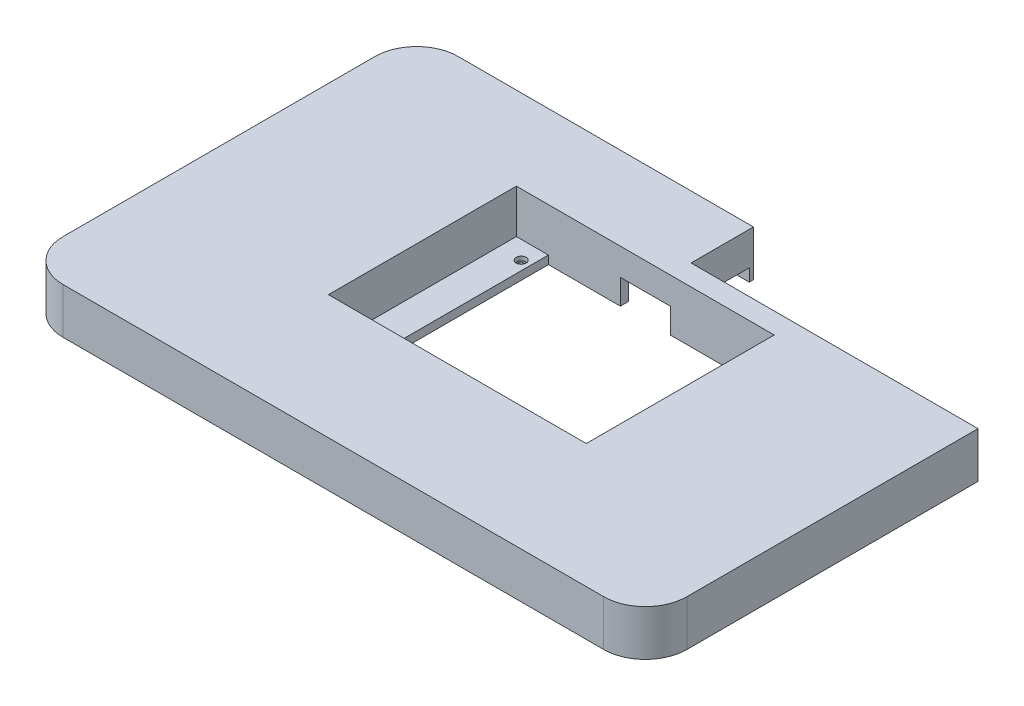
from build123d import *

# Parameters (mm, degrees)
EXTRUDE_1_DEPTH      = 1
SKETCH_2_W           = 69
SKETCH_2_H           = 15
CUT_EXTRUDE_1_DEPTH  = 1
EXTRUDE_START        = 10
EXTRUDE_2_DEPTH      = 10
SKETCH_4_R           = 2.5
EXTRUDE_3_DEPTH      = 10
SKETCH_5_R           = 1.5
CUT_EXTRUDE_2_DEPTH  = 2.8
SKETCH_6_R           = 1.1
CUT_EXTRUDE_4_DEPTH  = 4.2
SKETCH_7_W           = 68
SKETCH_7_H           = 1
EXTRUDE_4_DEPTH      = 7
SKETCH_8_R           = 2.5
EXTRUDE_5_DEPTH      = 10
SKETCH_9_R           = 1.5
CUT_EXTRUDE_5_DEPTH  = 2.8
SKETCH_10_R          = 1.1
CUT_EXTRUDE_6_DEPTH  = 4.2
SKETCH_11_W          = 62
SKETCH_11_H          = 45.2
CUT_EXTRUDE_7_DEPTH  = 10
SKETCH_12_R          = 2.5
CUT_EXTRUDE_8_DEPTH  = 10
SKETCH_13_W          = 66
SKETCH_13_H          = 49.2
SKETCH_13_W_2        = 62
SKETCH_13_H_2        = 45.2
EXTRUDE_6_DEPTH      = 11.5
EXTRUDE_9_DEPTH      = 2
SKETCH_16_R          = 2
CUT_EXTRUDE_12_DEPTH = 1
SKETCH_17_R          = 1.6
CUT_EXTRUDE_13_DEPTH = 2.8
SKETCH_18_R          = 1.2
CUT_EXTRUDE_14_DEPTH = 2
SKETCH_19_R          = 3.5
SKETCH_19_R_2        = 2.5
EXTRUDE_10_DEPTH     = 10
FILLET_2_R           = 2
SKETCH_20_W          = 62
SKETCH_20_H          = 45.2
CUT_EXTRUDE_15_DEPTH = 10.5
SKETCH_21_W          = 13.5
SKETCH_21_H          = 4.7
SKETCH_21_H_2        = 0.3
CUT_EXTRUDE_22_DEPTH = 15
SKETCH_24_W          = 10
SKETCH_24_H          = 10
SKETCH_24_W_2        = 5
EXTRUDE_11_DEPTH     = 5
SKETCH_25_W          = 5
SKETCH_25_H          = 10
EXTRUDE_12_DEPTH     = 1.6
SKETCH_27_W          = 11
SKETCH_27_H          = 5
EXTRUDE_13_DEPTH     = 1
SKETCH_28_W          = 11
SKETCH_28_H          = 5
EXTRUDE_14_DEPTH     = 1
SKETCH_29_W          = 5
SKETCH_29_H          = 2
EXTRUDE_15_DEPTH     = 6.6
SKETCH_30_W          = 6
SKETCH_30_H          = 6
CUT_EXTRUDE_23_DEPTH = 10
SKETCH_31_W          = 5
SKETCH_31_H          = 1.781037981
SKETCH_31_H_2        = 2
SKETCH_31_W_2        = 2
SKETCH_31_H_3        = 8
EXTRUDE_16_DEPTH     = 5
SKETCH_32_W          = 23
SKETCH_32_H          = 2
SKETCH_32_W_2        = 2
SKETCH_32_H_2        = 3
EXTRUDE_17_DEPTH     = 5


with BuildPart() as part:
    # 스케치1 → 보스-돌출1 (new body)
    with BuildSketch(Plane(origin=(0, 0, 0), x_dir=(1, 0, 0), z_dir=(0, 1, 0))):
        with BuildLine():
            Line((-65, 47.5), (65, 47.5))
            ThreePointArc((65, 47.5), (72.071067812, 44.571067812), (75, 37.5))
            Line((75, 37.5), (75, -37.5))
            ThreePointArc((75, -37.5), (72.071067812, -44.571067812), (65, -47.5))
            Line((65, -47.5), (-65, -47.5))
            ThreePointArc((-65, -47.5), (-72.071067812, -44.571067812), (-75, -37.5))
            Line((-75, -37.5), (-75, 37.5))
            ThreePointArc((-75, 37.5), (-72.071067812, 44.571067812), (-65, 47.5))
        make_face()
    extrude(amount=EXTRUDE_1_DEPTH)

    # 스케치2 → 컷-돌출1 (cut)
    with BuildSketch(Plane(origin=(0, 1, 0), x_dir=(1, 0, 0), z_dir=(0, 1, 0))):
        with Locations((40.5, 40)):
            Rectangle(SKETCH_2_W, SKETCH_2_H)
    extrude(amount=-CUT_EXTRUDE_1_DEPTH, mode=Mode.SUBTRACT)

    # 스케치3 → 보스-돌출2 (add)
    with BuildSketch(Plane.XZ.offset(EXTRUDE_START)):
        with BuildLine():
            Line((74, 37.5), (74, -31.5))
            Line((74, -31.5), (74, -32.5))
            Line((74, -32.5), (75, -32.5))
            Line((75, -32.5), (75, 37.5))
            ThreePointArc((75, 37.5), (72.071067812, 44.571067812), (65, 47.5))
            Line((65, 47.5), (-65, 47.5))
            ThreePointArc((-65, 47.5), (-72.071067812, 44.571067812), (-75, 37.5))
            Line((-75, 37.5), (-75, -37.5))
            ThreePointArc((-75, -37.5), (-72.071067812, -44.571067812), (-65, -47.5))
            Line((-65, -47.5), (6, -47.5))
            Line((6, -47.5), (6, -46.5))
            Line((6, -46.5), (5, -46.5))
            Line((5, -46.5), (-65, -46.5))
            ThreePointArc((-65, -46.5), (-71.363961031, -43.863961031), (-74, -37.5))
            Line((-74, -37.5), (-74, 37.5))
            ThreePointArc((-74, 37.5), (-71.363961031, 43.863961031), (-65, 46.5))
            Line((-65, 46.5), (65, 46.5))
            ThreePointArc((65, 46.5), (71.363961031, 43.863961031), (74, 37.5))
        make_face()
    extrude(amount=-EXTRUDE_2_DEPTH)

    # 스케치4 → 보스-돌출3 (add)
    with BuildSketch(Plane.XZ):
        with BuildLine():
            ThreePointArc((-57.5, 32.5), (-58.232233047, 34.267766953), (-60, 35))
            Line((-60, 35), (-60, 32.5))
            Line((-60, 32.5), (-62.5, 32.5))
            ThreePointArc((-62.5, 32.5), (-60, 30), (-57.5, 32.5))
        make_face()
        with BuildLine():
            Line((-60, 32.5), (-60, 35))
            ThreePointArc((-60, 35), (-61.767766953, 34.267766953), (-62.5, 32.5))
            Line((-62.5, 32.5), (-60, 32.5))
        make_face()
        with BuildLine():
            ThreePointArc((62.499632967, 32.5), (61.76739992, 34.267766953), (59.999632967, 35))
            Line((59.999632967, 35), (59.999632967, 32.5))
            Line((59.999632967, 32.5), (62.499632967, 32.5))
        make_face()
        with BuildLine():
            Line((59.999632967, 32.5), (59.999632967, 35))
            ThreePointArc((59.999632967, 35), (58.231866014, 30.732233047), (62.499632967, 32.5))
            Line((62.499632967, 32.5), (59.999632967, 32.5))
        make_face()
        with BuildLine():
            ThreePointArc((59.999632967, -27), (61.76739992, -26.267766953), (62.499632967, -24.5))
            Line((62.499632967, -24.5), (59.999632967, -24.5))
            Line((59.999632967, -24.5), (59.999632967, -27))
        make_face()
        with BuildLine():
            Line((59.999632967, -24.5), (62.499632967, -24.5))
            ThreePointArc((62.499632967, -24.5), (58.231866014, -22.732233047), (59.999632967, -27))
            Line((59.999632967, -27), (59.999632967, -24.5))
        make_face()
        with Locations(Location((-60, -24.5, 0), (0, 0, 270))):
            Circle(SKETCH_4_R)
    extrude(amount=EXTRUDE_3_DEPTH)

    # 스케치5 → 컷-돌출2 (cut)
    with BuildSketch(Plane.XZ.offset(10)):
        with Locations(Location((-60, -24.5, 0), (0, 0, 270))):
            Circle(SKETCH_5_R)
        with Locations(Location((-60, 32.5, 0), (0, 0, 270))):
            Circle(SKETCH_5_R)
        with Locations(Location((59.999632967, 32.5, 0), (0, 0, 270))):
            Circle(SKETCH_5_R)
        with Locations(Location((59.999632967, -24.5, 0), (0, 0, 270))):
            Circle(SKETCH_5_R)
    extrude(amount=-CUT_EXTRUDE_2_DEPTH, mode=Mode.SUBTRACT)

    # 스케치6 → 컷-돌출4 (cut)
    with BuildSketch(Plane.XZ.offset(7.2)):
        with Locations(Location((-60, -24.5, 0), (0, 0, 270))):
            Circle(SKETCH_6_R)
        with Locations(Location((-60, 32.5, 0), (0, 0, 270))):
            Circle(SKETCH_6_R)
        with Locations(Location((59.999632967, 32.5, 0), (0, 0, 270))):
            Circle(SKETCH_6_R)
        with Locations(Location((59.999632967, -24.5, 0), (0, 0, 270))):
            Circle(SKETCH_6_R)
    extrude(amount=-CUT_EXTRUDE_4_DEPTH, mode=Mode.SUBTRACT)

    # 스케치7 → 보스-돌출4 (add)
    with BuildSketch(Plane.XZ):
        Polygon((5, -46.5), (6, -46.5), (6, -32.5), (6, -31.5), (5, -31.5), align=None)
        with Locations((40, -32)):
            Rectangle(SKETCH_7_W, SKETCH_7_H)
    extrude(amount=EXTRUDE_4_DEPTH)

    # 스케치8 → 보스-돌출5 (add)
    with BuildSketch(Plane.XZ):
        with Locations(Location((0, 32.5, 0), (0, 0, 270))):
            Circle(SKETCH_8_R)
        with Locations(Location((0, -24.5, 0), (0, 0, 270))):
            Circle(SKETCH_8_R)
    extrude(amount=EXTRUDE_5_DEPTH)

    # 스케치9 → 컷-돌출5 (cut)
    with BuildSketch(Plane.XZ.offset(10)):
        with Locations(Location((0, 32.5, 0), (0, 0, 270))):
            Circle(SKETCH_9_R)
        with Locations(Location((0, -24.5, 0), (0, 0, 270))):
            Circle(SKETCH_9_R)
    extrude(amount=-CUT_EXTRUDE_5_DEPTH, mode=Mode.SUBTRACT)

    # 스케치10 → 컷-돌출6 (cut)
    with BuildSketch(Plane.XZ.offset(7.2)):
        with Locations(Location((0, 32.5, 0), (0, 0, 270))):
            Circle(SKETCH_10_R)
        with Locations(Location((0, -24.5, 0), (0, 0, 270))):
            Circle(SKETCH_10_R)
    extrude(amount=-CUT_EXTRUDE_6_DEPTH, mode=Mode.SUBTRACT)

    # 스케치11 → 컷-돌출7 (cut)
    with BuildSketch(Plane(origin=(0, 1, 0), x_dir=(1, 0, 0), z_dir=(0, 1, 0))):
        with Locations((0, 4.9)):
            Rectangle(SKETCH_11_W, SKETCH_11_H)
    extrude(amount=-CUT_EXTRUDE_7_DEPTH, mode=Mode.SUBTRACT)


with BuildPart() as cut_extrude_7_piece_1:
    # of the separate pieces the step leaves, piece 1, a body of its own (cut_extrude_7_pieces)
    add(part.part.solids().sort_by_distance((6, 1, -47.5))[0])

    # 스케치13 → 보스-돌출6 (add)
    with BuildSketch(Plane.XZ):
        with Locations((0, -4.9)):
            Rectangle(SKETCH_13_W, SKETCH_13_H)
        with Locations((0, -4.9)):
            Rectangle(SKETCH_13_W_2, SKETCH_13_H_2, mode=Mode.SUBTRACT)
    extrude(amount=EXTRUDE_6_DEPTH)

    # 스케치14 → 보스-돌출9 (add)
    with BuildSketch(Plane.XZ.offset(11.5)):
        with BuildLine():
            Line((-25.5, 17.7), (-31, 17.7))
            Line((-31, 17.7), (-31, 13.35))
            Line((-31, 13.35), (-26.7, 13.35))
            ThreePointArc((-26.7, 13.35), (-26.348528137, 14.198528137), (-25.5, 14.55))
            Line((-25.5, 14.55), (-25.5, 17.7))
        make_face()
        with BuildLine():
            Line((-23.3, 17.7), (-25.5, 17.7))
            Line((-25.5, 17.7), (-25.5, 14.55))
            ThreePointArc((-25.5, 14.55), (-24.651471863, 14.198528137), (-24.3, 13.35))
            ThreePointArc((-24.3, 13.35), (-25.5, 12.15), (-26.7, 13.35))
            Line((-26.7, 13.35), (-31, 13.35))
            Line((-31, 13.35), (-31, -23.15))
            Line((-31, -23.15), (-26.7, -23.15))
            ThreePointArc((-26.7, -23.15), (-25.5, -21.95), (-24.3, -23.15))
            ThreePointArc((-24.3, -23.15), (-24.651471863, -23.998528137), (-25.5, -24.35))
            Line((-25.5, -24.35), (-25.5, -27.5))
            Line((-25.5, -27.5), (-23.3, -27.5))
            Line((-23.3, -27.5), (-23.3, 17.7))
        make_face()
        with BuildLine():
            Line((-26.7, -23.15), (-31, -23.15))
            Line((-31, -23.15), (-31, -27.5))
            Line((-31, -27.5), (-25.5, -27.5))
            Line((-25.5, -27.5), (-25.5, -24.35))
            ThreePointArc((-25.5, -24.35), (-26.348528137, -23.998528137), (-26.7, -23.15))
        make_face()
        with BuildLine():
            Line((25.5, -24.35), (25.5, -27.5))
            Line((25.5, -27.5), (31, -27.5))
            Line((31, -27.5), (31, -23.15))
            Line((31, -23.15), (26.7, -23.15))
            ThreePointArc((26.7, -23.15), (26.348528137, -23.998528137), (25.5, -24.35))
        make_face()
        with BuildLine():
            Line((25.5, 17.7), (23.3, 17.7))
            Line((23.3, 17.7), (23.3, -27.5))
            Line((23.3, -27.5), (25.5, -27.5))
            Line((25.5, -27.5), (25.5, -24.35))
            ThreePointArc((25.5, -24.35), (24.651471863, -22.301471863), (26.7, -23.15))
            Line((26.7, -23.15), (31, -23.15))
            Line((31, -23.15), (31, 13.35))
            Line((31, 13.35), (26.7, 13.35))
            ThreePointArc((26.7, 13.35), (24.651471863, 12.501471863), (25.5, 14.55))
            Line((25.5, 14.55), (25.5, 17.7))
        make_face()
        with BuildLine():
            Line((31, 17.7), (25.5, 17.7))
            Line((25.5, 17.7), (25.5, 14.55))
            ThreePointArc((25.5, 14.55), (26.348528137, 14.198528137), (26.7, 13.35))
            Line((26.7, 13.35), (31, 13.35))
            Line((31, 13.35), (31, 17.7))
        make_face()
    extrude(amount=-EXTRUDE_9_DEPTH)

    # 스케치16 → 컷-돌출12 (cut)
    with BuildSketch(Plane.XZ.offset(11.5)):
        with Locations(Location((-25.5, 13.35, 0), (0, 0, 270))):
            Circle(SKETCH_16_R)
        with Locations(Location((-25.5, -23.15, 0), (0, 0, 270))):
            Circle(SKETCH_16_R)
        with Locations(Location((25.5, -23.15, 0), (0, 0, 270))):
            Circle(SKETCH_16_R)
        with Locations(Location((25.5, 13.35, 0), (0, 0, 270))):
            Circle(SKETCH_16_R)
    extrude(amount=-CUT_EXTRUDE_12_DEPTH, mode=Mode.SUBTRACT)

    # 스케치17 → 컷-돌출13 (cut)
    with BuildSketch(Plane.XZ.offset(10)):
        with Locations(Location((-60, -24.5, 0), (0, 0, 270))):
            Circle(SKETCH_17_R)
        with Locations(Location((-60, 32.5, 0), (0, 0, 270))):
            Circle(SKETCH_17_R)
        with Locations(Location((59.999632967, 32.5, 0), (0, 0, 270))):
            Circle(SKETCH_17_R)
        with Locations(Location((0, 32.5, 0), (0, 0, 270))):
            Circle(SKETCH_17_R)
        with Locations(Location((59.999632967, -24.5, 0), (0, 0, 270))):
            Circle(SKETCH_17_R)
    extrude(amount=-CUT_EXTRUDE_13_DEPTH, mode=Mode.SUBTRACT)

    # 스케치18 → 컷-돌출14 (cut)
    with BuildSketch(Plane.XZ.offset(7.2)):
        with Locations(Location((-60, -24.5, 0), (0, 0, 270))):
            Circle(SKETCH_18_R)
        with Locations(Location((-60, 32.5, 0), (0, 0, 270))):
            Circle(SKETCH_18_R)
        with Locations(Location((0, 32.5, 0), (0, 0, 270))):
            Circle(SKETCH_18_R)
        with Locations(Location((59.999632967, 32.5, 0), (0, 0, 270))):
            Circle(SKETCH_18_R)
        with Locations(Location((59.999632967, -24.5, 0), (0, 0, 270))):
            Circle(SKETCH_18_R)
    extrude(amount=-CUT_EXTRUDE_14_DEPTH, mode=Mode.SUBTRACT)

    # 스케치19 → 보스-돌출10 (add)
    # profile 1 of 5: a face of its own
    with BuildSketch(Plane.XZ):
        with Locations(Location((-60, 32.5, 0), (0, 0, 270))):
            Circle(SKETCH_19_R)
        with Locations((-60, 32.5)):
            Circle(SKETCH_19_R_2, mode=Mode.SUBTRACT)
    # profile 2 of 5: a face of its own
    with BuildSketch(Plane.XZ):
        with Locations(Location((-60, -24.5, 0), (0, 0, 270))):
            Circle(SKETCH_19_R)
        with Locations((-60, -24.5)):
            Circle(SKETCH_19_R_2, mode=Mode.SUBTRACT)
    # profile 3 of 5: a face of its own
    with BuildSketch(Plane.XZ):
        with Locations(Location((59.999632967, -24.5, 0), (0, 0, 270))):
            Circle(SKETCH_19_R)
        with Locations((59.999632967, -24.5)):
            Circle(SKETCH_19_R_2, mode=Mode.SUBTRACT)
    # profile 4 of 5: a face of its own
    with BuildSketch(Plane.XZ):
        with Locations(Location((59.999632967, 32.5, 0), (0, 0, 270))):
            Circle(SKETCH_19_R)
        with Locations((59.999632967, 32.5)):
            Circle(SKETCH_19_R_2, mode=Mode.SUBTRACT)
    # profile 5 of 5: a face of its own
    with BuildSketch(Plane.XZ):
        with Locations(Location((0, 32.5, 0), (0, 0, 270))):
            Circle(SKETCH_19_R)
        with Locations((0, 32.5)):
            Circle(SKETCH_19_R_2, mode=Mode.SUBTRACT)
    extrude(amount=EXTRUDE_10_DEPTH)

    # 필렛2
    fillet_2_edges = [cut_extrude_7_piece_1.edges().sort_by_distance(p)[0] for p in [
        (-31, -4.25, -27.5),
        (-31, -4.25, 17.7),
        (31, -4.25, -27.5),
        (31, -4.25, 17.7),
    ]]
    fillet(fillet_2_edges, radius=FILLET_2_R)

    # 스케치20 → 컷-돌출15 (cut)
    with BuildSketch(Plane(origin=(0, 1, 0), x_dir=(1, 0, 0), z_dir=(0, 1, 0))):
        with Locations((0, 4.9)):
            Rectangle(SKETCH_20_W, SKETCH_20_H)
    extrude(amount=-CUT_EXTRUDE_15_DEPTH, mode=Mode.SUBTRACT)

    # 스케치21 → 컷-돌출22 (cut)
    with BuildSketch(Plane.XY.offset(-46.5)):
        with Locations((-42, -2.35)):
            Rectangle(SKETCH_21_W, SKETCH_21_H)
        with Locations((-42, -4.85)):
            Rectangle(SKETCH_21_W, SKETCH_21_H_2)
        with Locations((-18, -2.35)):
            Rectangle(SKETCH_21_W, SKETCH_21_H)
        with Locations((-18, -4.85)):
            Rectangle(SKETCH_21_W, SKETCH_21_H_2)
    extrude(amount=-CUT_EXTRUDE_22_DEPTH, mode=Mode.SUBTRACT)

    # 스케치24 → 보스-돌출11 (add)
    with BuildSketch(Plane.XZ):
        with Locations((-6.25, -41.5)):
            Rectangle(SKETCH_24_W, SKETCH_24_H)
        with Locations((-53.75, -41.5)):
            Rectangle(SKETCH_24_W, SKETCH_24_H)
        with Locations((-30, -41.5)):
            Rectangle(SKETCH_24_W_2, SKETCH_24_H)
    extrude(amount=EXTRUDE_11_DEPTH)

    # 스케치25 → 보스-돌출12 (add)
    with BuildSketch(Plane.XZ.offset(5)):
        with Locations((-56.25, -41.5)):
            Rectangle(SKETCH_25_W, SKETCH_25_H)
        with Locations((-3.75, -41.5)):
            Rectangle(SKETCH_25_W, SKETCH_25_H)
    extrude(amount=EXTRUDE_12_DEPTH)

    # 스케치27 → 보스-돌출13 (add)
    with BuildSketch(Plane.ZY.offset(11.25)):
        with Locations((-42, -2.5)):
            Rectangle(SKETCH_27_W, SKETCH_27_H)
    extrude(amount=EXTRUDE_13_DEPTH)

    # 스케치28 → 보스-돌출14 (add)
    with BuildSketch(Plane(origin=(-48.75, 0, 0), x_dir=(0, 0, -1), z_dir=(1, 0, 0))):
        with Locations((42, -2.5)):
            Rectangle(SKETCH_28_W, SKETCH_28_H)
    extrude(amount=EXTRUDE_14_DEPTH)

    # 스케치29 → 보스-돌출15 (add)
    with BuildSketch(Plane.XZ):
        with Locations((-30, -32.5)):
            Rectangle(SKETCH_29_W, SKETCH_29_H)
        with Locations((-3.75, -32.5)):
            Rectangle(SKETCH_29_W, SKETCH_29_H)
        with Locations((-56.25, -32.5)):
            Rectangle(SKETCH_29_W, SKETCH_29_H)
    extrude(amount=EXTRUDE_15_DEPTH)

    # 스케치30 → 컷-돌출23 (cut)
    with BuildSketch(Plane(origin=(0, 0, -29.5), x_dir=(-1, 0, 0), z_dir=(0, 0, -1))):
        with Locations((-3, -8.5)):
            Rectangle(SKETCH_30_W, SKETCH_30_H)
        with Locations((3, -8.5)):
            Rectangle(SKETCH_30_W, SKETCH_30_H)
    extrude(amount=-CUT_EXTRUDE_23_DEPTH, mode=Mode.SUBTRACT)

    # 스케치31 → 보스-돌출16 (add)
    with BuildSketch(Plane.XZ):
        with Locations((71.5, 9.890518991)):
            Rectangle(SKETCH_31_W, SKETCH_31_H)
        with Locations((71.5, -22)):
            Rectangle(SKETCH_31_W, SKETCH_31_H_2)
        Polygon((44, -21), (42, -21), (42, -23), (52, -23), (52, -21), align=None)
        with Locations((43, -17)):
            Rectangle(SKETCH_31_W_2, SKETCH_31_H_3)
        Polygon((42, 10.781037981), (42, 9), (44, 9), (52, 9), (52, 10.781037981), align=None)
        with Locations((43, 5)):
            Rectangle(SKETCH_31_W_2, SKETCH_31_H_3)
    extrude(amount=EXTRUDE_16_DEPTH)

    # 스케치32 → 보스-돌출17 (add)
    with BuildSketch(Plane.XZ):
        with Locations((44.5, 18.7)):
            Rectangle(SKETCH_32_W, SKETCH_32_H)
        with Locations((15, 21.2)):
            Rectangle(SKETCH_32_W_2, SKETCH_32_H_2)
        with Locations((15, 45)):
            Rectangle(SKETCH_32_W_2, SKETCH_32_H_2)
    extrude(amount=EXTRUDE_17_DEPTH)


with BuildPart() as cut_extrude_7_piece_2:
    # of the separate pieces the step leaves, piece 2, a body of its own (cut_extrude_7_pieces)
    add(part.part.solids().sort_by_distance((0, -9, -27))[0])

    # 스케치12 → 컷-돌출8 (cut)
    with BuildSketch(Plane.XZ.offset(10)):
        with Locations((0, -24.5)):
            Circle(SKETCH_12_R)
    extrude(amount=-CUT_EXTRUDE_8_DEPTH, mode=Mode.SUBTRACT)


solid = cut_extrude_7_piece_1.part
